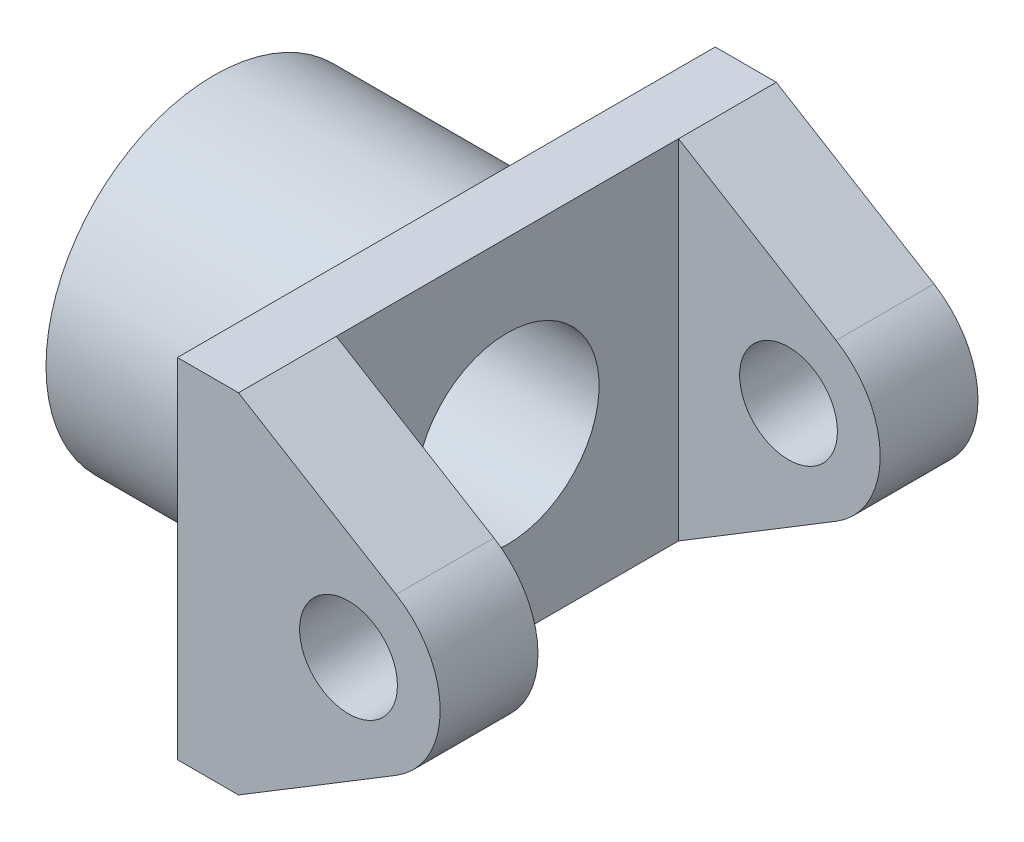
from build123d import *

# Parameters (mm, degrees)
SKETCH1_R           = 8
BOSS_EXTRUDE1_DEPTH = 16
SKETCH2_W           = 88
SKETCH2_H           = 57
BOSS_EXTRUDE2_DEPTH = 10
SKETCH3_R           = 8
BOSS_EXTRUDE3_DEPTH = 16
SKETCH4_R           = 27.5
BOSS_EXTRUDE4_DEPTH = 38
CUT_EXTRUDE2_DEPTH  = 92.105707834


with BuildPart() as part:
    # Sketch1 → Boss-Extrude1 (new body)
    with BuildSketch(Plane.XY):
        with BuildLine():
            Line((-28, 28.5), (-28, -28.5))
            Line((-28, -28.5), (-18, -28.5))
            Line((-18, -28.5), (7.793097747, -12.816693314))
            ThreePointArc((7.793097747, -12.816693314), (15, 0), (7.793097747, 12.816693314))
            Line((7.793097747, 12.816693314), (-18, 28.5))
            Line((-18, 28.5), (-28, 28.5))
        make_face()
        Circle(SKETCH1_R, mode=Mode.SUBTRACT)
    extrude(amount=-BOSS_EXTRUDE1_DEPTH)

    # Sketch2 → Boss-Extrude2 (add)
    with BuildSketch(Plane.ZY.offset(28)):
        with Locations((28, 0)):
            Rectangle(SKETCH2_W, SKETCH2_H)
    extrude(amount=-BOSS_EXTRUDE2_DEPTH)

    # Sketch3 → Boss-Extrude3 (add)
    with BuildSketch(Plane.XY.offset(72)):
        with BuildLine():
            Line((7.793097747, 12.816693314), (-18, 28.5))
            Line((-18, 28.5), (-18, -28.5))
            Line((-18, -28.5), (7.793097747, -12.816693314))
            ThreePointArc((7.793097747, -12.816693314), (15, 0), (7.793097747, 12.816693314))
        make_face()
        Circle(SKETCH3_R, mode=Mode.SUBTRACT)
    extrude(amount=-BOSS_EXTRUDE3_DEPTH)

    # Sketch4 → Boss-Extrude4 (add)
    with BuildSketch(Plane.ZY.offset(28)):
        with Locations((28, 0)):
            Circle(SKETCH4_R)
        with BuildLine():
            Line((47, 4), (47, -4))
            Line((47, -4), (42.456832295, -4))
            ThreePointArc((42.456832295, -4), (13, 0), (42.456832295, 4))
            Line((42.456832295, 4), (47, 4))
        make_face(mode=Mode.SUBTRACT)
    extrude(amount=BOSS_EXTRUDE4_DEPTH)

    # Sketch5 → Cut-Extrude2 (cut, through all)
    with BuildSketch(Plane(origin=(-18, 0, 0), x_dir=(0, 0, -1), z_dir=(1, 0, 0))):
        with BuildLine():
            Line((-47, -4), (-47, 4))
            Line((-47, 4), (-42.456832295, 4))
            ThreePointArc((-42.456832295, 4), (-13, 0), (-42.456832295, -4))
            Line((-42.456832295, -4), (-47, -4))
        make_face()
    extrude(amount=-CUT_EXTRUDE2_DEPTH, mode=Mode.SUBTRACT)


solid = part.part
